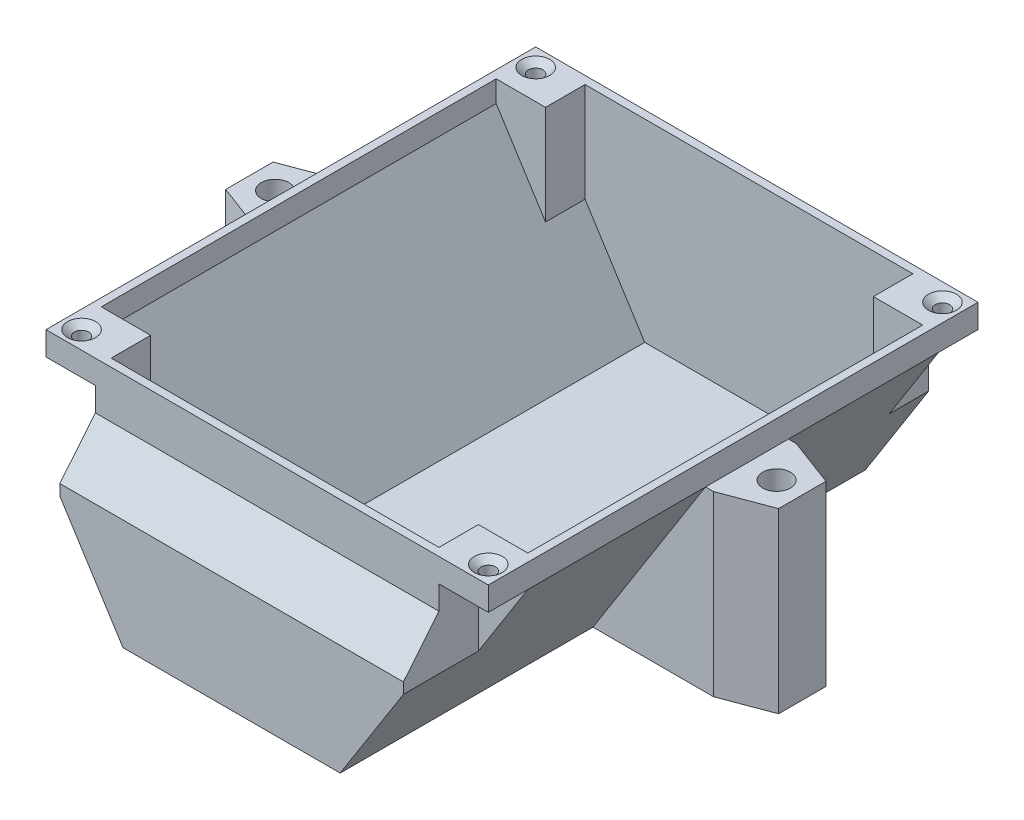
from build123d import *

# Parameters (mm, degrees)
MAIN_BODY_DEPTH                                   = 124
SKETCH38_W                                        = 112
SKETCH38_H                                        = 124
BOSS_EXTRUDE2_DEPTH                               = 6
SCREW_CUT_REACH                                   = 159.953
SKETCH22_W                                        = 12.496184963
SKETCH22_H                                        = 10
BOX_START                                         = -71.003815
BOX_EXTENSION_DEPTH                               = 87.00763
CUT_EXTRUDE1_DEPTH                                = 158.953315888
INNER_SHELL_T                                     = -2
ANGLE_SUPPORTS_DEPTH                              = 21
SCREW_START                                       = -45
SKETCH9_R                                         = 3.5
SKETCH9_W                                         = 2
SKETCH9_H                                         = 21
SCREW_SUPPORT_DEPTH                               = 45
SKETCH14_W                                        = 12.496184963
SKETCH14_H                                        = 10
BOX_SCREW_SUPPORT_DEPTH                           = 6
CSK_FOR_6_FLAT_HEAD_MACHINE_SCREW_100_D           = 3.6576
CSK_FOR_6_FLAT_HEAD_MACHINE_SCREW_100_CSINK_D     = 7.0866
CSK_FOR_6_FLAT_HEAD_MACHINE_SCREW_100_CSINK_ANGLE = 100
LPATTERN1_COUNT                                   = 2
LPATTERN1_PITCH                                   = 103
LPATTERN1_COUNT_DIR2                              = 2
LPATTERN1_PITCH_DIR2                              = 115


with BuildPart() as part:
    # Front face → Main Body (new body)
    with BuildSketch(Plane.XY):
        Polygon((-28.5, 45), (83.5, 45), (55, 0), (0, 0), align=None)
    extrude(amount=MAIN_BODY_DEPTH)

    # Sketch38 → Boss-Extrude2 (add)
    with BuildSketch(Plane(origin=(0, 45, 0), x_dir=(1, 0, 0), z_dir=(0, 1, 0))):
        with Locations((27.5, -62)):
            Rectangle(SKETCH38_W, SKETCH38_H)
    extrude(amount=BOSS_EXTRUDE2_DEPTH)

    # Sketch22 → Screw Cut (cut, up to next)
    with BuildSketch(Plane(origin=(0, 51, 0), x_dir=(1, 0, 0), z_dir=(0, 1, 0)), mode=Mode.PRIVATE) as screw_cut_sk1:
        with Locations((-22.251907519, -5)):
            Rectangle(SKETCH22_W, SKETCH22_H)
    screw_cut_tool1 = extrude(screw_cut_sk1.sketch, amount=-SCREW_CUT_REACH, mode=Mode.PRIVATE) & part.part
    # Sketch22 → Screw Cut (cut, up to next)
    with BuildSketch(Plane(origin=(0, 51, 0), x_dir=(1, 0, 0), z_dir=(0, 1, 0)), mode=Mode.PRIVATE) as screw_cut_sk2:
        with Locations((77.251907519, -5)):
            Rectangle(SKETCH22_W, SKETCH22_H)
    screw_cut_tool2 = extrude(screw_cut_sk2.sketch, amount=-SCREW_CUT_REACH, mode=Mode.PRIVATE) & part.part
    # Sketch22 → Screw Cut (cut, up to next)
    with BuildSketch(Plane(origin=(0, 51, 0), x_dir=(1, 0, 0), z_dir=(0, 1, 0)), mode=Mode.PRIVATE) as screw_cut_sk3:
        with Locations((77.251907519, -119)):
            Rectangle(SKETCH22_W, SKETCH22_H)
    screw_cut_tool3 = extrude(screw_cut_sk3.sketch, amount=-SCREW_CUT_REACH, mode=Mode.PRIVATE) & part.part
    # Sketch22 → Screw Cut (cut, up to next)
    with BuildSketch(Plane(origin=(0, 51, 0), x_dir=(1, 0, 0), z_dir=(0, 1, 0)), mode=Mode.PRIVATE) as screw_cut_sk4:
        with Locations((-22.251907519, -119)):
            Rectangle(SKETCH22_W, SKETCH22_H)
    screw_cut_tool4 = extrude(screw_cut_sk4.sketch, amount=-SCREW_CUT_REACH, mode=Mode.PRIVATE) & part.part
    add(screw_cut_tool1.solids().sort_by_distance((-22.251908, 51, 5))[0], mode=Mode.SUBTRACT)
    add(screw_cut_tool2.solids().sort_by_distance((77.251908, 51, 5))[0], mode=Mode.SUBTRACT)
    add(screw_cut_tool3.solids().sort_by_distance((77.251908, 51, 119))[0], mode=Mode.SUBTRACT)
    add(screw_cut_tool4.solids().sort_by_distance((-22.251908, 51, 119))[0], mode=Mode.SUBTRACT)

    # Sketch23 → Box Extension (add)
    with BuildSketch(Plane.ZY.offset(BOX_START)):
        Polygon((124, 0), (124, 39), (133.001495165, 28), (133.001495165, 0), align=None)
    extrude(amount=BOX_EXTENSION_DEPTH)

    # Sketch28 → Cut-Extrude1 (cut, through all)
    with BuildSketch(Plane(origin=(0, 0, 124), x_dir=(-1, 0, 0), z_dir=(0, 0, -1))):
        Polygon((-71.003815037, 0), (-55, 0), (-71.003815037, 25.269181637), align=None)
        Polygon((0, 0), (16.003815037, 0), (16.003815037, 25.269181637), align=None)
    extrude(amount=-CUT_EXTRUDE1_DEPTH, mode=Mode.SUBTRACT)

    # Inner Shell
    inner_shell_openings = [part.faces().sort_by_distance(p)[0] for p in [
        (27.5, 51, 62),
    ]]
    offset(amount=INNER_SHELL_T, openings=inner_shell_openings, kind=Kind.INTERSECTION)

    # Support → Angle supports (add)
    with BuildSketch(Plane(origin=(0, 0, 48), x_dir=(-1, 0, 0), z_dir=(0, 0, -1))):
        Polygon((0, 0), (28.5, 0), (28.5, 45), align=None)
        Polygon((-83.5, 45), (-55, 0), (-83.5, 0), align=None)
    extrude(amount=-ANGLE_SUPPORTS_DEPTH)

    # Sketch9 → Screw Support (add)
    # profile 1 of 4: a face of its own
    with BuildSketch(Plane.XZ.offset(SCREW_START)):
        Polygon((97.5, 64.5), (85.5, 69), (85.5, 48), (97.5, 52.5), align=None)
        with Locations(Location((91, 58.5, 0), (0, 0, 270))):
            Circle(SKETCH9_R, mode=Mode.SUBTRACT)
    # profile 2 of 4: a face of its own
    with BuildSketch(Plane.XZ.offset(SCREW_START)):
        with Locations((84.5, 58.5)):
            Rectangle(SKETCH9_W, SKETCH9_H)
    # profile 3 of 4: a face of its own
    with BuildSketch(Plane.XZ.offset(SCREW_START)):
        Polygon((-42.5, 52.5), (-30.5, 48), (-30.5, 69), (-42.5, 64.5), align=None)
        with Locations(Location((-36, 58.5, 0), (0, 0, 270))):
            Circle(SKETCH9_R, mode=Mode.SUBTRACT)
    # profile 4 of 4: a face of its own
    with BuildSketch(Plane.XZ.offset(SCREW_START)):
        with Locations((-29.5, 58.5)):
            Rectangle(SKETCH9_W, SKETCH9_H)
    extrude(amount=SCREW_SUPPORT_DEPTH)

    # Sketch14 → Box Screw support (add)
    with BuildSketch(Plane(origin=(0, 51, 0), x_dir=(1, 0, 0), z_dir=(0, 1, 0))):
        with Locations((-22.251907519, -5)):
            Rectangle(SKETCH14_W, SKETCH14_H)
        with Locations((77.251907519, -5)):
            Rectangle(SKETCH14_W, SKETCH14_H)
        with Locations((77.251907519, -119)):
            Rectangle(SKETCH14_W, SKETCH14_H)
        with Locations((-22.251907519, -119)):
            Rectangle(SKETCH14_W, SKETCH14_H)
    extrude(amount=-BOX_SCREW_SUPPORT_DEPTH)

    # CSK for #6 Flat Head Machine Screw (100)3 (through all)
    with Locations(Plane(origin=(-24, 51, 119.5), x_dir=(0, 0, 1), z_dir=(0, 1, 0))):
        with Locations((0, 0)):
            csk_for_6_flat_head_machine_screw_100 = CounterSinkHole(CSK_FOR_6_FLAT_HEAD_MACHINE_SCREW_100_D / 2, CSK_FOR_6_FLAT_HEAD_MACHINE_SCREW_100_CSINK_D / 2, counter_sink_angle=CSK_FOR_6_FLAT_HEAD_MACHINE_SCREW_100_CSINK_ANGLE)

    # LPattern1: CSK for _6 Flat Head Machine Screw _100 2 × 2
    with Locations(*[(i * LPATTERN1_PITCH, 0, -j * LPATTERN1_PITCH_DIR2) for i in range(LPATTERN1_COUNT) for j in range(LPATTERN1_COUNT_DIR2) if (i, j) != (0, 0)]):
        add(csk_for_6_flat_head_machine_screw_100, mode=Mode.SUBTRACT)


solid = part.part
